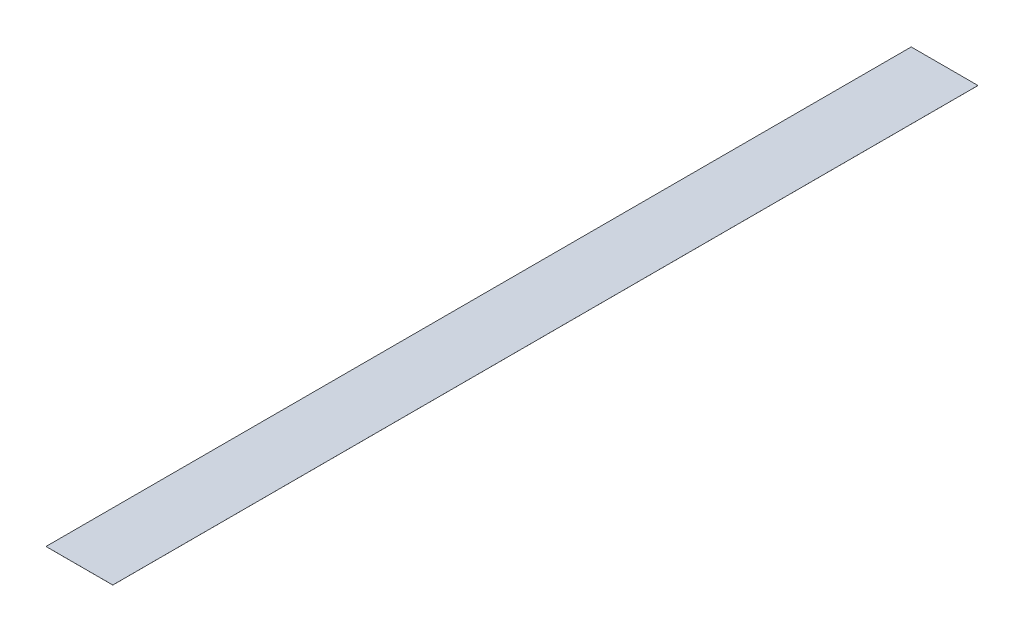
from build123d import *

# Parameters (mm, degrees)
ESBO_O1_W                 = 20
ESBO_O1_H                 = 259.078549656
RESSALTO_EXTRUS_O17_DEPTH = 0.01


with BuildPart() as part:
    # Esboço1 → Ressalto-extrusão17 (new body)
    with BuildSketch(Plane(origin=(0, 0, 0), x_dir=(1, 0, 0), z_dir=(0, 1, 0))):
        with Locations((-1819.709134436, 535.213648906)):
            Rectangle(ESBO_O1_W, ESBO_O1_H)
    extrude(amount=RESSALTO_EXTRUS_O17_DEPTH)


solid = part.part
